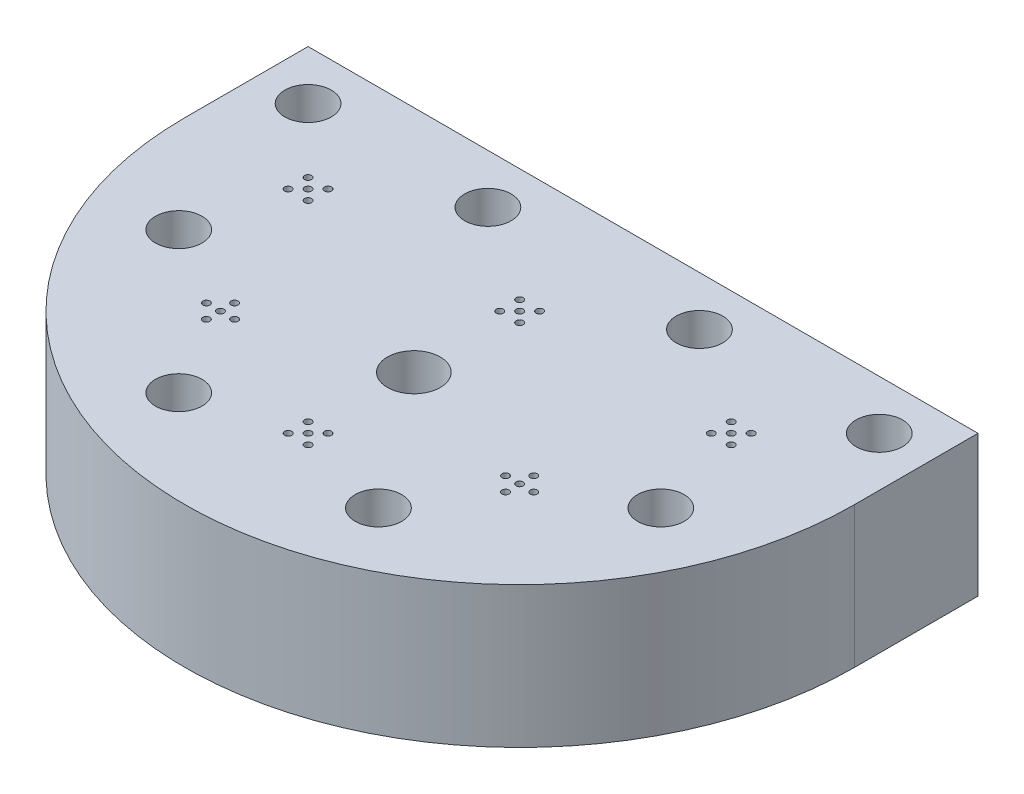
from build123d import *

# Parameters (mm, degrees)
BOSS_EXTRUDE1_DEPTH  = 20
SKETCH2_R            = 7.5
CUT_EXTRUDE1_DEPTH   = 9.5
CIRPATTERN1_COUNT    = 5
CIRPATTERN1_ANGLE    = 180
SKETCH5_R            = 0.5
CUT_EXTRUDE2_DEPTH   = 83.953300115
M6_CLEARANCE_HOLE1_D = 6.6
SKETCH8_R            = 3.75
CUT_EXTRUDE3_DEPTH   = 83.953300115


with BuildPart() as part:
    # Sketch1 → Boss-Extrude1 (new body)
    with BuildSketch(Plane(origin=(0, 0, 0), x_dir=(1, 0, 0), z_dir=(0, 1, 0))):
        with BuildLine():
            Line((-47.5, 0), (47.5, 0))
            Line((47.5, 0), (47.5, -17.5))
            ThreePointArc((47.5, -17.5), (0, -65), (-47.5, -17.5))
            Line((-47.5, -17.5), (-47.5, 0))
        make_face()
    extrude(amount=BOSS_EXTRUDE1_DEPTH)

    # Sketch2 → Cut-Extrude1 (cut)
    with BuildSketch(Plane.XZ):
        with Locations((30, 17.5)):
            Circle(SKETCH2_R)
        with Locations((0, 17.5)):
            Circle(SKETCH2_R)
        with Locations((-30, 17.5)):
            Circle(SKETCH2_R)
        with Locations((0, 47.5)):
            Circle(SKETCH2_R)
        with Locations((-21.213203436, 38.713203436)):
            Circle(SKETCH2_R)
        with Locations((21.213203436, 38.713203436)):
            Circle(SKETCH2_R)
    extrude(amount=-CUT_EXTRUDE1_DEPTH, mode=Mode.SUBTRACT)

    # Sketch3 → Cut-Revolve1 (revolve, cut)
    with BuildSketch(Plane(origin=(0, 0, 17.5), x_dir=(-1, 0, 0), z_dir=(0, 0, -1))):
        with BuildLine():
            Line((0, 9.5), (0, 17))
            ThreePointArc((0, 17), (5.303300859, 14.803300859), (7.5, 9.5))
            Line((7.5, 9.5), (0, 9.5))
        make_face()
    revolve(axis=Axis((0, 9.5, 17.5), (0, 1, 0)), mode=Mode.SUBTRACT)

    # Sketch4 → Cut-Revolve2 (revolve, cut)
    with BuildSketch(Plane(origin=(0, 0, 17.5), x_dir=(-1, 0, 0), z_dir=(0, 0, -1))):
        with BuildLine():
            Line((-30, 9.5), (-30, 17))
            ThreePointArc((-30, 17), (-24.696699141, 14.803300859), (-22.5, 9.5))
            Line((-22.5, 9.5), (-30, 9.5))
        make_face()
    cut_revolve2 = revolve(axis=Axis((30, 9.5, 17.5), (0, 1, 0)), mode=Mode.SUBTRACT)

    # CirPattern1: Cut-Revolve2 ×5 about axis
    cirpattern1_axis = Axis((0, 9.5, 17.5), (0, -1, 0))
    for i in range(1, CIRPATTERN1_COUNT):
        add(cut_revolve2.rotate(cirpattern1_axis, i * CIRPATTERN1_ANGLE / (CIRPATTERN1_COUNT - 1)), mode=Mode.SUBTRACT)

    # Sketch5 → Cut-Extrude2 (cut, through all)
    with BuildSketch(Plane(origin=(0, 20, 0), x_dir=(1, 0, 0), z_dir=(0, 1, 0))):
        with Locations((21.213203436, -38.713203436)):
            Circle(SKETCH5_R)
        with Locations((21.213203436, -40.713203436)):
            Circle(SKETCH5_R)
        with Locations((19.213203436, -38.713203436)):
            Circle(SKETCH5_R)
        with Locations((23.213203436, -38.713203436)):
            Circle(SKETCH5_R)
        with Locations((21.213203436, -36.713203436)):
            Circle(SKETCH5_R)
        with Locations((1.414213562, -46.085786438)):
            Circle(SKETCH5_R)
        with Locations((1.414213562, -48.914213562)):
            Circle(SKETCH5_R)
        with Locations((0, -47.5)):
            Circle(SKETCH5_R)
        with Locations((-1.414213562, -46.085786438)):
            Circle(SKETCH5_R)
        with Locations((-1.414213562, -48.914213562)):
            Circle(SKETCH5_R)
        with Locations((-19.213203436, -38.713203436)):
            Circle(SKETCH5_R)
        with Locations((-21.213203436, -40.713203436)):
            Circle(SKETCH5_R)
        with Locations((-21.213203436, -38.713203436)):
            Circle(SKETCH5_R)
        with Locations((-21.213203436, -36.713203436)):
            Circle(SKETCH5_R)
        with Locations((-23.213203436, -38.713203436)):
            Circle(SKETCH5_R)
        with Locations((-28.585786438, -18.914213562)):
            Circle(SKETCH5_R)
        with Locations((-31.414213562, -18.914213562)):
            Circle(SKETCH5_R)
        with Locations((-30, -17.5)):
            Circle(SKETCH5_R)
        with Locations((-28.585786438, -16.085786438)):
            Circle(SKETCH5_R)
        with Locations((-31.414213562, -16.085786438)):
            Circle(SKETCH5_R)
        with Locations((28.585786438, -16.085786438)):
            Circle(SKETCH5_R)
        with Locations((31.414213562, -16.085786438)):
            Circle(SKETCH5_R)
        with Locations((30, -17.5)):
            Circle(SKETCH5_R)
        with Locations((28.585786438, -18.914213562)):
            Circle(SKETCH5_R)
        with Locations((31.414213562, -18.914213562)):
            Circle(SKETCH5_R)
        with Locations((1.414213562, -18.914213562)):
            Circle(SKETCH5_R)
        with Locations((-1.414213562, -18.914213562)):
            Circle(SKETCH5_R)
        with Locations((0, -17.5)):
            Circle(SKETCH5_R)
        with Locations((1.414213562, -16.085786438)):
            Circle(SKETCH5_R)
        with Locations((-1.414213562, -16.085786438)):
            Circle(SKETCH5_R)
    extrude(amount=-CUT_EXTRUDE2_DEPTH, mode=Mode.SUBTRACT)

    # M6 Clearance Hole1 (through all)
    with Locations(Plane(origin=(0, 20, 0), x_dir=(1, 0, 0), z_dir=(0, 1, 0))):
        with Locations((-40.5, -7), (-15, -7), (15, -7), (40.5, -7), (-34.183542703, -31.659286998), (-14.159286998, -51.683542703), (14.159286998, -51.683542703), (34.183542703, -31.659286998)):
            Hole(M6_CLEARANCE_HOLE1_D / 2)

    # Sketch8 → Cut-Extrude3 (cut, through all)
    with BuildSketch(Plane(origin=(0, 20, 0), x_dir=(1, 0, 0), z_dir=(0, 1, 0))):
        with Locations((0, -32.5)):
            Circle(SKETCH8_R)
    extrude(amount=-CUT_EXTRUDE3_DEPTH, mode=Mode.SUBTRACT)

    # Sketch9 → Cut-Revolve3 (revolve, cut)
    with BuildSketch(Plane(origin=(0, 0, 0), x_dir=(0, 0, -1), z_dir=(1, 0, 0))):
        with BuildLine():
            Line((-5, 2.627), (-5, 0))
            Line((-5, 0), (-7.627, 0))
            ThreePointArc((-7.627, 0), (-6.857569514, 1.857569514), (-5, 2.627))
        make_face()
    revolve(axis=Axis((0, 2.627, 5), (0, -1, 0)), mode=Mode.SUBTRACT)

    # Sketch10 → Cut-Revolve4 (revolve, cut)
    with BuildSketch(Plane(origin=(0, 0, 0), x_dir=(0, 0, -1), z_dir=(1, 0, 0))):
        with BuildLine():
            Line((-63.127, 0), (-60.5, 0))
            Line((-60.5, 0), (-60.5, 2.627))
            ThreePointArc((-60.5, 2.627), (-62.357569514, 1.857569514), (-63.127, 0))
        make_face()
    revolve(axis=Axis((0, 0, 60.5), (0, 1, 0)), mode=Mode.SUBTRACT)


solid = part.part
